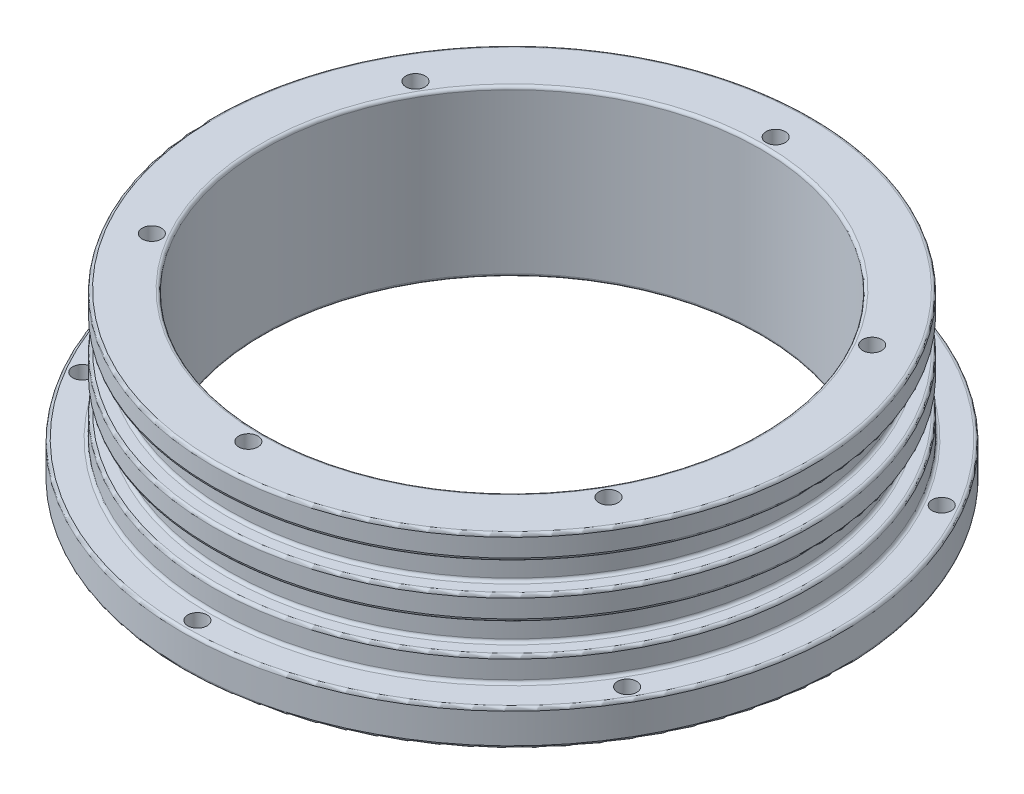
from build123d import *

# Parameters (mm, degrees)
SKETCH1_R           = 55
SKETCH1_R_2         = 1.6
BOSS_EXTRUDE1_DEPTH = 6
SKETCH2_R           = 50
BOSS_EXTRUDE2_DEPTH = 21.6
SKETCH3_R           = 41.5
CUT_EXTRUDE1_DEPTH  = 83.533387184
SKETCH5_R           = 1.6
CUT_EXTRUDE2_DEPTH  = 5
SKETCH6_R           = 50
SKETCH6_R_2         = 46
CUT_EXTRUDE3_DEPTH  = 2.7
SKETCH7_W           = 2.7
SKETCH7_H           = 4.8
FILLET1_R           = 0.5


with BuildPart() as part:
    # Sketch1 → Boss-Extrude1 (new body)
    with BuildSketch(Plane(origin=(0, 0, 0), x_dir=(1, 0, 0), z_dir=(0, 1, 0))):
        with Locations(Location((0, 0, 0), (0, 0, 270))):
            Circle(SKETCH1_R)
        with Locations(Location((0, 52.5, 0), (0, 0, 270))):
            Circle(SKETCH1_R_2, mode=Mode.SUBTRACT)
        with Locations(Location((45.466333699, 26.25, 0), (0, 0, 270))):
            Circle(SKETCH1_R_2, mode=Mode.SUBTRACT)
        with Locations(Location((45.466333699, -26.25, 0), (0, 0, 270))):
            Circle(SKETCH1_R_2, mode=Mode.SUBTRACT)
        with Locations(Location((0, -52.5, 0), (0, 0, 270))):
            Circle(SKETCH1_R_2, mode=Mode.SUBTRACT)
        with Locations(Location((-45.466333699, -26.25, 0), (0, 0, 270))):
            Circle(SKETCH1_R_2, mode=Mode.SUBTRACT)
        with Locations(Location((-45.466333699, 26.25, 0), (0, 0, 270))):
            Circle(SKETCH1_R_2, mode=Mode.SUBTRACT)
    extrude(amount=BOSS_EXTRUDE1_DEPTH)

    # Sketch2 → Boss-Extrude2 (add)
    with BuildSketch(Plane(origin=(0, 6, 0), x_dir=(1, 0, 0), z_dir=(0, 1, 0))):
        with Locations(Location((0, 0, 0), (0, 0, 90))):
            Circle(SKETCH2_R)
    extrude(amount=BOSS_EXTRUDE2_DEPTH)

    # Sketch3 → Cut-Extrude1 (cut, through all)
    with BuildSketch(Plane(origin=(0, 27.6, 0), x_dir=(1, 0, 0), z_dir=(0, 1, 0))):
        with Locations(Location((0, 0, 0), (0, 0, 270))):
            Circle(SKETCH3_R)
    extrude(amount=-CUT_EXTRUDE1_DEPTH, mode=Mode.SUBTRACT)

    # Sketch5 → Cut-Extrude2 (cut)
    with BuildSketch(Plane(origin=(0, 27.6, 0), x_dir=(1, 0, 0), z_dir=(0, 1, 0))):
        with Locations(Location((0, 44, 0), (0, 0, 270))):
            Circle(SKETCH5_R)
        with Locations(Location((38.105117767, 22, 0), (0, 0, 270))):
            Circle(SKETCH5_R)
        with Locations(Location((38.105117767, -22, 0), (0, 0, 270))):
            Circle(SKETCH5_R)
        with Locations(Location((0, -44, 0), (0, 0, 270))):
            Circle(SKETCH5_R)
        with Locations(Location((-38.105117767, -22, 0), (0, 0, 270))):
            Circle(SKETCH5_R)
        with Locations(Location((-38.105117767, 22, 0), (0, 0, 270))):
            Circle(SKETCH5_R)
    extrude(amount=-CUT_EXTRUDE2_DEPTH, mode=Mode.SUBTRACT)

    # Sketch6 → Cut-Extrude3 (cut)
    with BuildSketch(Plane.XZ):
        with Locations(Location((0, 0, 0), (0, 0, 270))):
            Circle(SKETCH6_R)
        with Locations(Location((0, 0, 0), (0, 0, 270))):
            Circle(SKETCH6_R_2, mode=Mode.SUBTRACT)
    extrude(amount=-CUT_EXTRUDE3_DEPTH, mode=Mode.SUBTRACT)

    # Sketch7 → Cut-Revolve1 (revolve, cut)
    with BuildSketch(Plane(origin=(0, 0, 0), x_dir=(0, 0, -1), z_dir=(1, 0, 0)), mode=Mode.PRIVATE) as cut_revolve1_sk:
        with Locations((-48.65, 21.2)):
            Rectangle(SKETCH7_W, SKETCH7_H)
        with Locations((-48.65, 12.4)):
            Rectangle(SKETCH7_W, SKETCH7_H)
    revolve(cut_revolve1_sk.sketch.rotate(Axis((0, 0, 0), (0, 1, 0)), 180), axis=Axis((0, 0, 0), (0, 1, 0)), mode=Mode.SUBTRACT)

    # Fillet1
    fillet1_edges = [part.edges().sort_by_distance(p)[0] for p in [
        (0, 0, -55),
        (0, 6, 50),
        (0, 27.6, 50),
        (0, 0, -41.5),
        (0, 27.6, -41.5),
        (0, 6, -55),
        (0, 2.7, 50),
        (0, 2.7, 46),
        (0, 0, 50),
        (0, 0, 46),
        (0, 23.6, 50),
        (0, 18.8, 50),
        (0, 18.8, 47.3),
        (0, 23.6, 47.3),
        (0, 14.8, 50),
        (0, 10, 50),
        (0, 10, 47.3),
        (0, 14.8, 47.3),
    ]]
    fillet(fillet1_edges, radius=FILLET1_R)


solid = part.part
